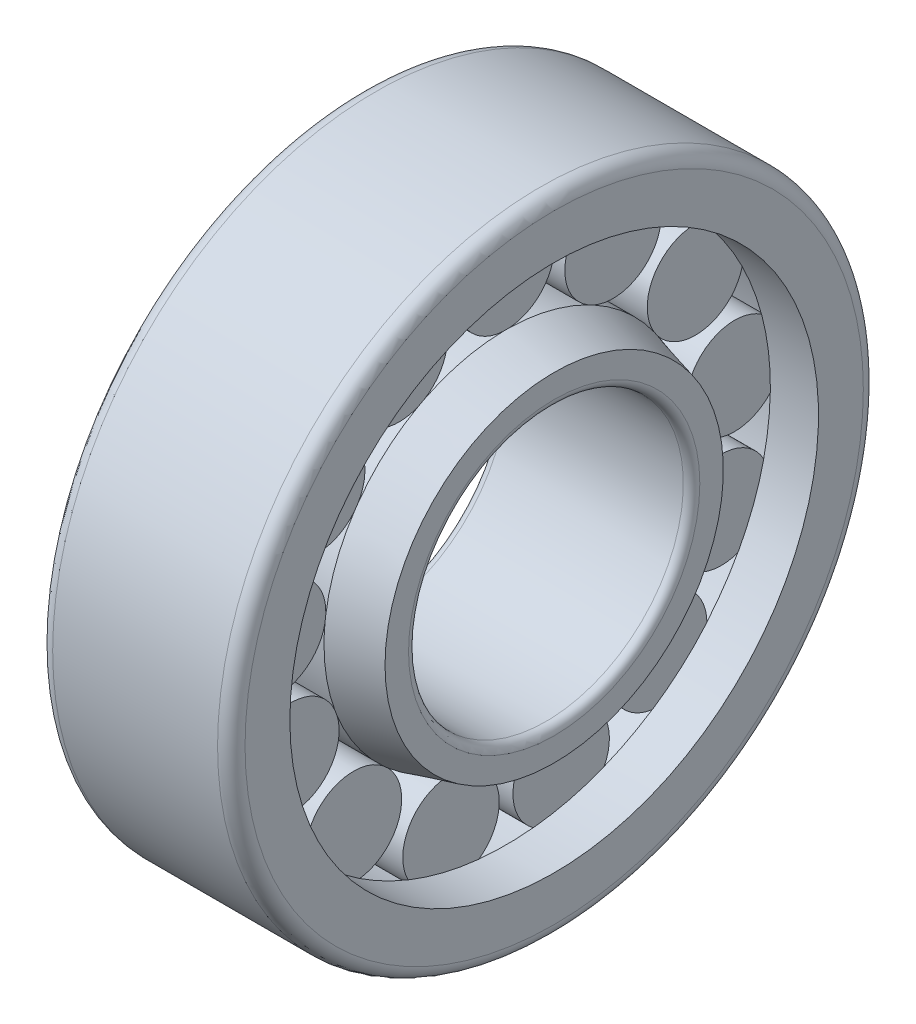
from build123d import *

# Parameters (mm, degrees)
SKETCH2_W               = 7
SKETCH2_H               = 3.51
CIRCULAR_PATTERN1_COUNT = 13
FILLET1_R               = 1
FILLET2_R               = 0.6


with BuildPart() as part:
    # Sketch1 → Revolve1 (revolve)
    with BuildSketch(Plane.XY, mode=Mode.PRIVATE) as revolve1_sk:
        Polygon((-7, 10), (7, 10), (7, 12.312177826), (3.5, 13.25), (-3.5, 13.25), (-7, 12.312177826), align=None)
    revolve(revolve1_sk.sketch.rotate(Axis((-10.137871204, 0, 0), (1, 0, 0)), 90), axis=Axis((-10.137871204, 0, 0), (1, 0, 0)))

    # Sketch2 → Revolve2 (revolve)
    with BuildSketch(Plane.XY):
        with Locations((0, 14.995)):
            Rectangle(SKETCH2_W, SKETCH2_H)
    revolve2 = revolve(axis=Axis((-7.422783257, 16.75, 0), (1, 0, 0)))

    # Sketch3 → Revolve3 (revolve)
    with BuildSketch(Plane.XY, mode=Mode.PRIVATE) as revolve3_sk:
        Polygon((-7, 23.5), (7, 23.5), (7, 19.2375), (3.49, 19.2375), (3.49, 20.25), (-3.49, 20.25), (-3.49, 19.2375), (-7, 19.2375), align=None)
    revolve(revolve3_sk.sketch.rotate(Axis((-9.082213196, 0, 0), (1, 0, 0)), 90), axis=Axis((-9.082213196, 0, 0), (1, 0, 0)))

    # Circular-Pattern1: Revolve2 ×13 about axis
    circular_pattern1_axis = Axis((0, 0, 0), (1, 0, 0))
    for i in range(1, CIRCULAR_PATTERN1_COUNT):
        add(revolve2.rotate(circular_pattern1_axis, i * 360 / CIRCULAR_PATTERN1_COUNT))

    # Fillet1
    fillet1_edges = [part.edges().sort_by_distance(p)[0] for p in [
        (-7, 0, -23.5),
        (7, 0, -23.5),
    ]]
    fillet(fillet1_edges, radius=FILLET1_R)

    # Fillet2
    fillet2_edges = [part.edges().sort_by_distance(p)[0] for p in [
        (7, 0, -10),
        (-7, 0, -10),
    ]]
    fillet(fillet2_edges, radius=FILLET2_R)


solid = part.part
